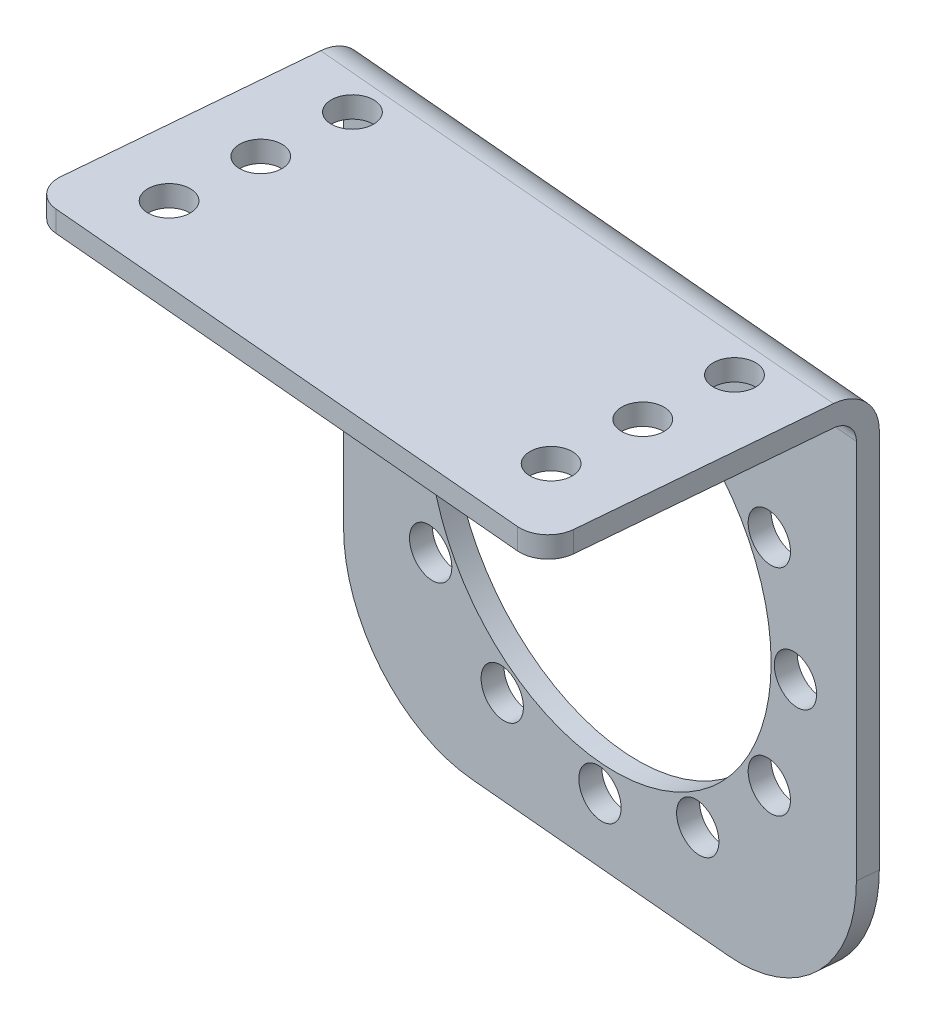
from build123d import *

# Parameters (mm, degrees)
SKETCH1_W                      = 40
SKETCH1_H                      = 40
BOSS_EXTRUDE1_DEPTH            = 22
SKETCH2_W                      = 20.5
SKETCH2_H                      = 38.5
CUT_EXTRUDE1_DEPTH             = 60.896458739
M24_CLEARANCE_HOLE1_D          = 26.7
M24_CLEARANCE_HOLE1_DEPTH      = 4.972963553
F_3_3_3_3_DIAMETER_HOLE1_D     = 3.3
F_3_3_3_3_DIAMETER_HOLE1_DEPTH = 4.972963553
F_3_0_3_DIAMETER_HOLE1_D       = 3
FILLET1_R                      = 1.5
FILLET2_R                      = 2
FILLET3_R                      = 3
FILLET4_R                      = 10


with BuildPart() as part:
    # Sketch1 → Boss-Extrude1 (new body)
    with BuildSketch(Plane(origin=(-1.395486846, 0, 15.950487634), x_dir=(0, -1, 0), z_dir=(-0.08715574274765787, 0, 0.9961946980917457))):
        with Locations((-20.4, -0.261467228)):
            Rectangle(SKETCH1_W, SKETCH1_H)
    extrude(amount=-BOSS_EXTRUDE1_DEPTH)

    # Sketch2 → Cut-Extrude1 (cut, through all)
    with BuildSketch(Plane(origin=(19.663421695, 0, 1.720326484), x_dir=(0.08715574274765787, 0, -0.9961946980917455), z_dir=(0.9961946980917455, 3.832107347333544e-15, 0.08715574274765787))):
        with Locations((-5.761415906, 19.65)):
            Rectangle(SKETCH2_W, SKETCH2_H)
    extrude(amount=-CUT_EXTRUDE1_DEPTH, mode=Mode.SUBTRACT)

    # M24 Clearance Hole1
    with Locations(Plane(origin=(0.391205881, 0, -4.471503677), x_dir=(0.9961946980917455, 0, 0.08715574274765787), z_dir=(-0.08715574274765787, 0, 0.9961946980917455))):
        with Locations((-0.261467228, 20.2)):
            Hole(M24_CLEARANCE_HOLE1_D / 2, depth=M24_CLEARANCE_HOLE1_DEPTH)

    # Ø3.3 (3.3) Diameter Hole1
    with Locations(Plane(origin=(0.391205881, 0, -4.471503677), x_dir=(0.9961946980917455, 0, 0.08715574274765787), z_dir=(-0.08715574274765787, 0, 0.9961946980917455))):
        with Locations((-0.261467228, 4.95), (-7.886467228, 6.993112592), (-13.468354636, 12.575), (-15.511467228, 20.2), (-13.468354636, 27.825), (-7.886467228, 33.406887408), (-0.261467228, 35.45), (7.363532772, 33.406887408), (12.945420179, 27.825), (14.988532772, 20.2), (12.945420179, 12.575), (7.363532772, 6.993112592)):
            Hole(F_3_3_3_3_DIAMETER_HOLE1_D / 2, depth=F_3_3_3_3_DIAMETER_HOLE1_DEPTH)

    # Ø3.0 (3) Diameter Hole1 (through all)
    with Locations(Plane(origin=(0, 38.9, 0), x_dir=(-1, 0, 0), z_dir=(0, -1, 0))):
        with Locations((-14.651558368, -0.490248903), (-14.128623911, -6.467417091), (-13.605689455, -12.44458528), (15.035043636, 2.106992231), (15.557978092, -3.870175957), (16.080912549, -9.847344146)):
            Hole(F_3_0_3_DIAMETER_HOLE1_D / 2)

    # Fillet1
    fillet1_edges = [part.edges().sort_by_distance(p)[0] for p in [
        (0.130733614, 38.9, -4.494292047),
    ]]
    fillet(fillet1_edges, radius=FILLET1_R)

    # Fillet2
    fillet2_edges = [part.edges().sort_by_distance(p)[0] for p in [
        (18.26793485, 39.65, 17.670814119),
        (-21.579853074, 39.65, 14.184584409),
    ]]
    fillet(fillet2_edges, radius=FILLET2_R)

    # Fillet3
    fillet3_edges = [part.edges().sort_by_distance(p)[0] for p in [
        (0.261467228, 40.4, -5.988584094),
    ]]
    fillet(fillet3_edges, radius=FILLET3_R)

    # Fillet4
    fillet4_edges = [part.edges().sort_by_distance(p)[0] for p in [
        (20.119994383, 0.4, -3.498323216),
        (-19.727793541, 0.4, -6.984552926),
    ]]
    fillet(fillet4_edges, radius=FILLET4_R)


solid = part.part
